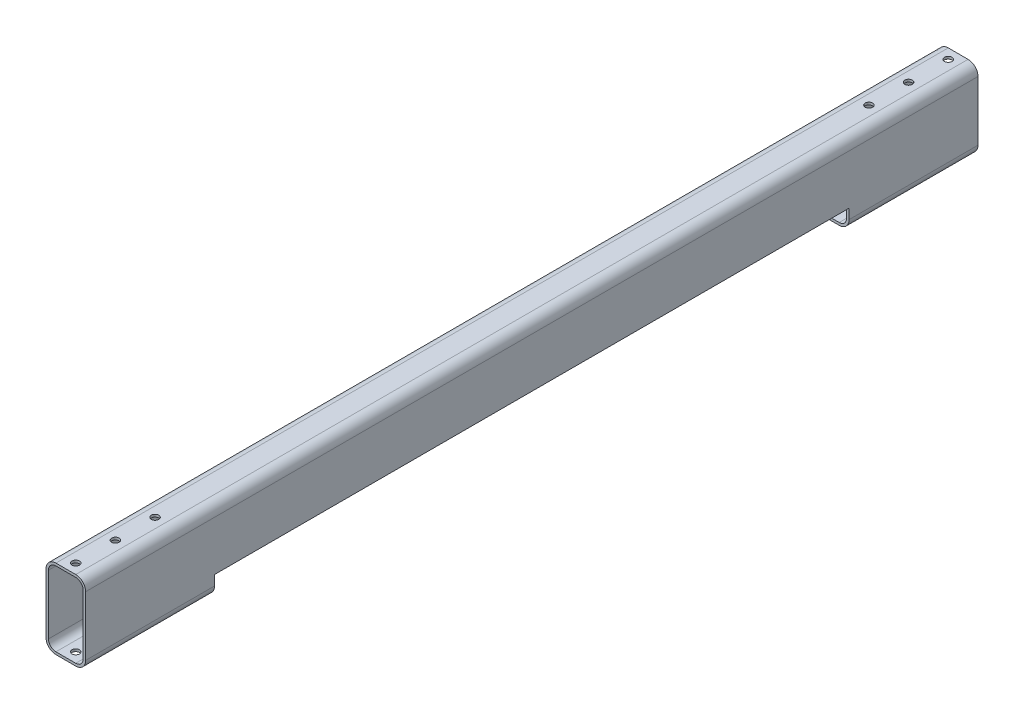
from build123d import *

# Parameters (mm, degrees)
EXTRUDE_THIN1_DEPTH               = 571.5
F_3_16_0_1875_DIAMETER_HOLE1_D    = 4.7625
SKETCH5_W                         = 406.4
SKETCH5_H                         = 12.7
CUT_EXTRUDE1_DEPTH                = 573.627776134
F_3_16_0_195_DIAMETER_HOLE1_D     = 4.953
F_3_16_0_195_DIAMETER_HOLE1_DEPTH = 25.4
F_3_16_0_195_DIAMETER_HOLE1_TIP   = 1.488031323


with BuildPart() as part:
    # Sketch1 → Extrude-Thin1 (new body)
    with BuildSketch(Plane.XY):
        with BuildLine():
            Line((-12.7, 19.05), (-12.7, -19.05))
            ThreePointArc((-12.7, -19.05), (-10.840128061, -23.540128061), (-6.35, -25.4))
            Line((-6.35, -25.4), (6.35, -25.4))
            ThreePointArc((6.35, -25.4), (10.840128061, -23.540128061), (12.7, -19.05))
            Line((12.7, -19.05), (12.7, 19.05))
            ThreePointArc((12.7, 19.05), (10.840128061, 23.540128061), (6.35, 25.4))
            Line((6.35, 25.4), (-6.35, 25.4))
            ThreePointArc((-6.35, 25.4), (-10.840128061, 23.540128061), (-12.7, 19.05))
        make_face()
        with BuildLine():
            Line((-11.1125, 19.05), (-11.1125, -19.05))
            ThreePointArc((-11.1125, -19.05), (-9.717596045, -22.417596045), (-6.35, -23.8125))
            Line((-6.35, -23.8125), (6.35, -23.8125))
            ThreePointArc((6.35, -23.8125), (9.717596045, -22.417596045), (11.1125, -19.05))
            Line((11.1125, -19.05), (11.1125, 19.05))
            ThreePointArc((11.1125, 19.05), (9.717596045, 22.417596045), (6.35, 23.8125))
            Line((6.35, 23.8125), (-6.35, 23.8125))
            ThreePointArc((-6.35, 23.8125), (-9.717596045, 22.417596045), (-11.1125, 19.05))
        make_face(mode=Mode.SUBTRACT)
    extrude(amount=EXTRUDE_THIN1_DEPTH)

    # 3/16 (0.1875) Diameter Hole1 (through all)
    with Locations(Plane(origin=(0, 25.4, 565.15), x_dir=(0, 0, 1), z_dir=(0, 1, 0))):
        with Locations((0, 0), (-558.8, 0), (-533.4, 0), (-508, 0), (-25.4, 0), (-50.8, 0)):
            Hole(F_3_16_0_1875_DIAMETER_HOLE1_D / 2)

    # Sketch5 → Cut-Extrude1 (cut, through all)
    with BuildSketch(Plane(origin=(12.7, 0, 0), x_dir=(0, 0, -1), z_dir=(1, 0, 0))):
        with Locations((-285.75, -19.05)):
            Rectangle(SKETCH5_W, SKETCH5_H)
    extrude(amount=-CUT_EXTRUDE1_DEPTH, mode=Mode.SUBTRACT)

    # 3/16 (0.195) Diameter Hole1
    with Locations(Plane(origin=(0, -25.4, 0), x_dir=(-1, 0, 0), z_dir=(0, -1, 0))):
        with Locations((2.54, -495.3), (-5.08, -502.92), (-5.08, -68.58), (2.54, -76.2)):
            Hole(F_3_16_0_195_DIAMETER_HOLE1_D / 2, depth=F_3_16_0_195_DIAMETER_HOLE1_DEPTH)
            with Locations((0, 0, -(F_3_16_0_195_DIAMETER_HOLE1_DEPTH + F_3_16_0_195_DIAMETER_HOLE1_TIP / 2))):  # 118° drill point
                Cone(0, F_3_16_0_195_DIAMETER_HOLE1_D / 2, F_3_16_0_195_DIAMETER_HOLE1_TIP, mode=Mode.SUBTRACT)


solid = part.part
